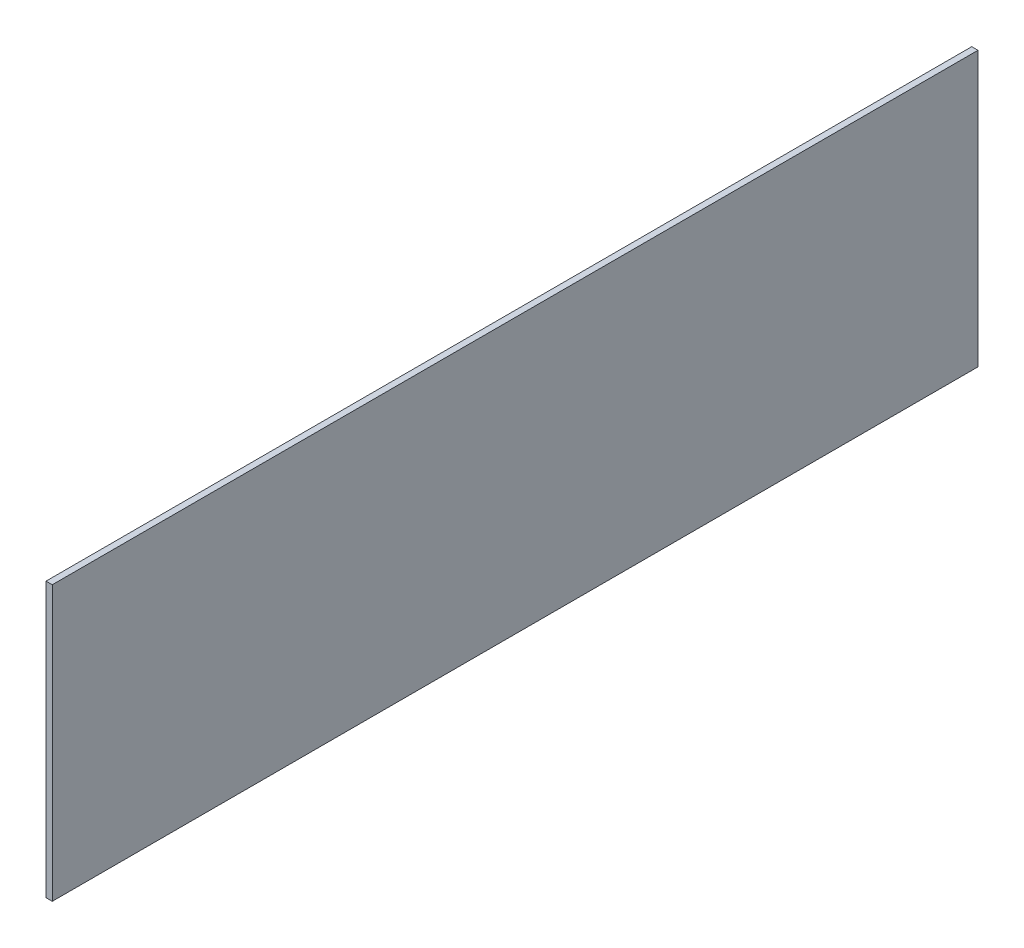
from build123d import *

# Parameters (mm, degrees)
SKETCH1_W           = 12
SKETCH1_H           = 526
BOSS_EXTRUDE1_DEPTH = 1776


with BuildPart() as part:
    # Sketch1 → Boss-Extrude1 (new body)
    with BuildSketch(Plane.XY):
        with Locations((-55.263157895, -135.421052632)):
            Rectangle(SKETCH1_W, SKETCH1_H)
    extrude(amount=BOSS_EXTRUDE1_DEPTH)


solid = part.part
